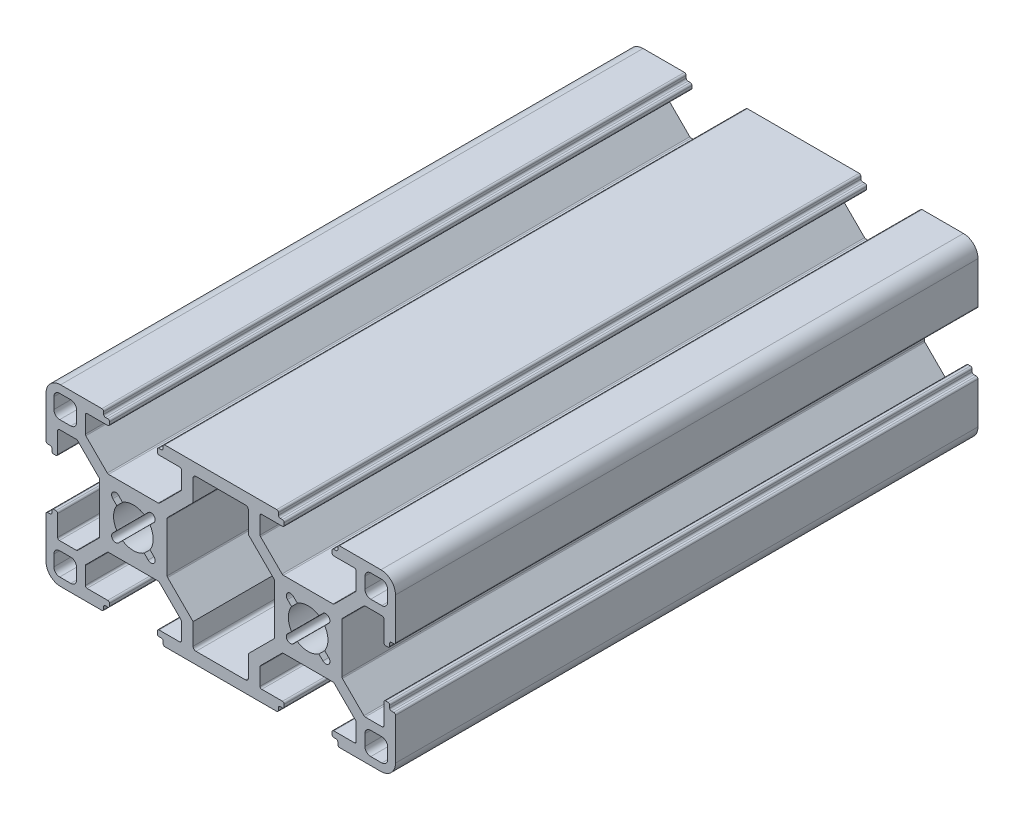
from build123d import *

# Parameters (mm, degrees)
EXTRUDE_1_DEPTH = 100


with BuildPart() as part:
    # 草图1 → 凸台-拉伸1 (new body)
    with BuildSketch(Plane.XY):
        with BuildLine():
            Line((7.95, -13), (4.4, -13))
            ThreePointArc((4.4, -13), (4.187867966, -13.087867966), (4.1, -13.3))
            Line((4.1, -13.3), (4.1, -13.7))
            ThreePointArc((4.1, -13.7), (4.187867966, -13.912132034), (4.4, -14))
            Line((4.4, -14), (4.8, -14))
            ThreePointArc((4.8, -14), (5.012132034, -14.087867966), (5.1, -14.3))
            Line((5.1, -14.3), (5.1, -14.7))
            ThreePointArc((5.1, -14.7), (5.187867966, -14.912132034), (5.4, -15))
            Line((5.4, -15), (24.6, -15))
            ThreePointArc((24.6, -15), (24.812132034, -14.912132034), (24.9, -14.7))
            Line((24.9, -14.7), (24.9, -14.3))
            ThreePointArc((24.9, -14.3), (24.987867966, -14.087867966), (25.2, -14))
            Line((25.2, -14), (25.6, -14))
            ThreePointArc((25.6, -14), (25.812132034, -13.912132034), (25.9, -13.7))
            Line((25.9, -13.7), (25.9, -13.3))
            ThreePointArc((25.9, -13.3), (25.812132034, -13.087867966), (25.6, -13))
            Line((25.6, -13), (22.05, -13))
            ThreePointArc((22.05, -13), (21.837867966, -12.912132034), (21.75, -12.7))
            Line((21.75, -12.7), (21.75, -9.788477631))
            ThreePointArc((21.75, -9.788477631), (21.77283614, -9.673672601), (21.837867966, -9.576345597))
            Line((21.837867966, -9.576345597), (25.526345597, -5.887867966))
            ThreePointArc((25.526345597, -5.887867966), (25.623672601, -5.82283614), (25.738477631, -5.8))
            Line((25.738477631, -5.8), (34.261522369, -5.8))
            ThreePointArc((34.261522369, -5.8), (34.376327399, -5.82283614), (34.473654403, -5.887867966))
            Line((34.473654403, -5.887867966), (38.162132034, -9.576345597))
            ThreePointArc((38.162132034, -9.576345597), (38.22716386, -9.673672601), (38.25, -9.788477631))
            Line((38.25, -9.788477631), (38.25, -12.7))
            ThreePointArc((38.25, -12.7), (38.162132034, -12.912132034), (37.95, -13))
            Line((37.95, -13), (34.4, -13))
            ThreePointArc((34.4, -13), (34.187867966, -13.087867966), (34.1, -13.3))
            Line((34.1, -13.3), (34.1, -13.7))
            ThreePointArc((34.1, -13.7), (34.187867966, -13.912132034), (34.4, -14))
            Line((34.4, -14), (34.8, -14))
            ThreePointArc((34.8, -14), (35.012132034, -14.087867966), (35.1, -14.3))
            Line((35.1, -14.3), (35.1, -14.7))
            ThreePointArc((35.1, -14.7), (35.187867966, -14.912132034), (35.4, -15))
            Line((35.4, -15), (42.5, -15))
            ThreePointArc((42.5, -15), (44.267766953, -14.267766953), (45, -12.5))
            Line((45, -12.5), (45, -5.4))
            ThreePointArc((45, -5.4), (44.912132034, -5.187867966), (44.7, -5.1))
            Line((44.7, -5.1), (44.3, -5.1))
            ThreePointArc((44.3, -5.1), (44.087867966, -5.012132034), (44, -4.8))
            Line((44, -4.8), (44, -4.4))
            ThreePointArc((44, -4.4), (43.912132034, -4.187867966), (43.7, -4.1))
            Line((43.7, -4.1), (43.3, -4.1))
            ThreePointArc((43.3, -4.1), (43.087867966, -4.187867966), (43, -4.4))
            Line((43, -4.4), (43, -7.95))
            ThreePointArc((43, -7.95), (42.912132034, -8.162132034), (42.7, -8.25))
            Line((42.7, -8.25), (39.788477631, -8.25))
            ThreePointArc((39.788477631, -8.25), (39.673672601, -8.22716386), (39.576345597, -8.162132034))
            Line((39.576345597, -8.162132034), (35.887867966, -4.473654403))
            ThreePointArc((35.887867966, -4.473654403), (35.82283614, -4.376327399), (35.8, -4.261522369))
            Line((35.8, -4.261522369), (35.8, 4.261522369))
            ThreePointArc((35.8, 4.261522369), (35.82283614, 4.376327399), (35.887867966, 4.473654403))
            Line((35.887867966, 4.473654403), (39.576345597, 8.162132034))
            ThreePointArc((39.576345597, 8.162132034), (39.673672601, 8.22716386), (39.788477631, 8.25))
            Line((39.788477631, 8.25), (42.7, 8.25))
            ThreePointArc((42.7, 8.25), (42.912132034, 8.162132034), (43, 7.95))
            Line((43, 7.95), (43, 4.4))
            ThreePointArc((43, 4.4), (43.087867966, 4.187867966), (43.3, 4.1))
            Line((43.3, 4.1), (43.7, 4.1))
            ThreePointArc((43.7, 4.1), (43.912132034, 4.187867966), (44, 4.4))
            Line((44, 4.4), (44, 4.8))
            ThreePointArc((44, 4.8), (44.087867966, 5.012132034), (44.3, 5.1))
            Line((44.3, 5.1), (44.7, 5.1))
            ThreePointArc((44.7, 5.1), (44.912132034, 5.187867966), (45, 5.4))
            Line((45, 5.4), (45, 12.5))
            ThreePointArc((45, 12.5), (44.267766953, 14.267766953), (42.5, 15))
            Line((42.5, 15), (35.4, 15))
            ThreePointArc((35.4, 15), (35.187867966, 14.912132034), (35.1, 14.7))
            Line((35.1, 14.7), (35.1, 14.3))
            ThreePointArc((35.1, 14.3), (35.012132034, 14.087867966), (34.8, 14))
            Line((34.8, 14), (34.4, 14))
            ThreePointArc((34.4, 14), (34.187867966, 13.912132034), (34.1, 13.7))
            Line((34.1, 13.7), (34.1, 13.3))
            ThreePointArc((34.1, 13.3), (34.187867966, 13.087867966), (34.4, 13))
            Line((34.4, 13), (37.95, 13))
            ThreePointArc((37.95, 13), (38.162132034, 12.912132034), (38.25, 12.7))
            Line((38.25, 12.7), (38.25, 9.788477631))
            ThreePointArc((38.25, 9.788477631), (38.22716386, 9.673672601), (38.162132034, 9.576345597))
            Line((38.162132034, 9.576345597), (34.473654403, 5.887867966))
            ThreePointArc((34.473654403, 5.887867966), (34.376327399, 5.82283614), (34.261522369, 5.8))
            Line((34.261522369, 5.8), (25.738477631, 5.8))
            ThreePointArc((25.738477631, 5.8), (25.623672601, 5.82283614), (25.526345597, 5.887867966))
            Line((25.526345597, 5.887867966), (21.837867966, 9.576345597))
            ThreePointArc((21.837867966, 9.576345597), (21.77283614, 9.673672601), (21.75, 9.788477631))
            Line((21.75, 9.788477631), (21.75, 12.7))
            ThreePointArc((21.75, 12.7), (21.837867966, 12.912132034), (22.05, 13))
            Line((22.05, 13), (25.6, 13))
            ThreePointArc((25.6, 13), (25.812132034, 13.087867966), (25.9, 13.3))
            Line((25.9, 13.3), (25.9, 13.7))
            ThreePointArc((25.9, 13.7), (25.812132034, 13.912132034), (25.6, 14))
            Line((25.6, 14), (25.2, 14))
            ThreePointArc((25.2, 14), (24.987867966, 14.087867966), (24.9, 14.3))
            Line((24.9, 14.3), (24.9, 14.7))
            ThreePointArc((24.9, 14.7), (24.812132034, 14.912132034), (24.6, 15))
            Line((24.6, 15), (5.4, 15))
            ThreePointArc((5.4, 15), (5.187867966, 14.912132034), (5.1, 14.7))
            Line((5.1, 14.7), (5.1, 14.3))
            ThreePointArc((5.1, 14.3), (5.012132034, 14.087867966), (4.8, 14))
            Line((4.8, 14), (4.4, 14))
            ThreePointArc((4.4, 14), (4.187867966, 13.912132034), (4.1, 13.7))
            Line((4.1, 13.7), (4.1, 13.3))
            ThreePointArc((4.1, 13.3), (4.187867966, 13.087867966), (4.4, 13))
            Line((4.4, 13), (7.95, 13))
            ThreePointArc((7.95, 13), (8.162132034, 12.912132034), (8.25, 12.7))
            Line((8.25, 12.7), (8.25, 9.788477631))
            ThreePointArc((8.25, 9.788477631), (8.22716386, 9.673672601), (8.162132034, 9.576345597))
            Line((8.162132034, 9.576345597), (4.473654403, 5.887867966))
            ThreePointArc((4.473654403, 5.887867966), (4.376327399, 5.82283614), (4.261522369, 5.8))
            Line((4.261522369, 5.8), (-4.261522369, 5.8))
            ThreePointArc((-4.261522369, 5.8), (-4.376327399, 5.82283614), (-4.473654403, 5.887867966))
            Line((-4.473654403, 5.887867966), (-8.162132034, 9.576345597))
            ThreePointArc((-8.162132034, 9.576345597), (-8.22716386, 9.673672601), (-8.25, 9.788477631))
            Line((-8.25, 9.788477631), (-8.25, 12.7))
            ThreePointArc((-8.25, 12.7), (-8.162132034, 12.912132034), (-7.95, 13))
            Line((-7.95, 13), (-4.4, 13))
            ThreePointArc((-4.4, 13), (-4.187867966, 13.087867966), (-4.1, 13.3))
            Line((-4.1, 13.3), (-4.1, 13.7))
            ThreePointArc((-4.1, 13.7), (-4.187867966, 13.912132034), (-4.4, 14))
            Line((-4.4, 14), (-4.8, 14))
            ThreePointArc((-4.8, 14), (-5.012132034, 14.087867966), (-5.1, 14.3))
            Line((-5.1, 14.3), (-5.1, 14.7))
            ThreePointArc((-5.1, 14.7), (-5.187867966, 14.912132034), (-5.4, 15))
            Line((-5.4, 15), (-12.5, 15))
            ThreePointArc((-12.5, 15), (-14.267766953, 14.267766953), (-15, 12.5))
            Line((-15, 12.5), (-15, 5.4))
            ThreePointArc((-15, 5.4), (-14.912132034, 5.187867966), (-14.7, 5.1))
            Line((-14.7, 5.1), (-14.3, 5.1))
            ThreePointArc((-14.3, 5.1), (-14.087867966, 5.012132034), (-14, 4.8))
            Line((-14, 4.8), (-14, 4.4))
            ThreePointArc((-14, 4.4), (-13.912132034, 4.187867966), (-13.7, 4.1))
            Line((-13.7, 4.1), (-13.3, 4.1))
            ThreePointArc((-13.3, 4.1), (-13.087867966, 4.187867966), (-13, 4.4))
            Line((-13, 4.4), (-13, 7.95))
            ThreePointArc((-13, 7.95), (-12.912132034, 8.162132034), (-12.7, 8.25))
            Line((-12.7, 8.25), (-9.788477631, 8.25))
            ThreePointArc((-9.788477631, 8.25), (-9.673672601, 8.22716386), (-9.576345597, 8.162132034))
            Line((-9.576345597, 8.162132034), (-5.887867966, 4.473654403))
            ThreePointArc((-5.887867966, 4.473654403), (-5.82283614, 4.376327399), (-5.8, 4.261522369))
            Line((-5.8, 4.261522369), (-5.8, -4.261522369))
            ThreePointArc((-5.8, -4.261522369), (-5.82283614, -4.376327399), (-5.887867966, -4.473654403))
            Line((-5.887867966, -4.473654403), (-9.576345597, -8.162132034))
            ThreePointArc((-9.576345597, -8.162132034), (-9.673672601, -8.22716386), (-9.788477631, -8.25))
            Line((-9.788477631, -8.25), (-12.7, -8.25))
            ThreePointArc((-12.7, -8.25), (-12.912132034, -8.162132034), (-13, -7.95))
            Line((-13, -7.95), (-13, -4.4))
            ThreePointArc((-13, -4.4), (-13.087867966, -4.187867966), (-13.3, -4.1))
            Line((-13.3, -4.1), (-13.7, -4.1))
            ThreePointArc((-13.7, -4.1), (-13.912132034, -4.187867966), (-14, -4.4))
            Line((-14, -4.4), (-14, -4.8))
            ThreePointArc((-14, -4.8), (-14.087867966, -5.012132034), (-14.3, -5.1))
            Line((-14.3, -5.1), (-14.7, -5.1))
            ThreePointArc((-14.7, -5.1), (-14.912132034, -5.187867966), (-15, -5.4))
            Line((-15, -5.4), (-15, -12.5))
            ThreePointArc((-15, -12.5), (-14.267766953, -14.267766953), (-12.5, -15))
            Line((-12.5, -15), (-5.4, -15))
            ThreePointArc((-5.4, -15), (-5.187867966, -14.912132034), (-5.1, -14.7))
            Line((-5.1, -14.7), (-5.1, -14.3))
            ThreePointArc((-5.1, -14.3), (-5.012132034, -14.087867966), (-4.8, -14))
            Line((-4.8, -14), (-4.4, -14))
            ThreePointArc((-4.4, -14), (-4.187867966, -13.912132034), (-4.1, -13.7))
            Line((-4.1, -13.7), (-4.1, -13.3))
            ThreePointArc((-4.1, -13.3), (-4.187867966, -13.087867966), (-4.4, -13))
            Line((-4.4, -13), (-7.95, -13))
            ThreePointArc((-7.95, -13), (-8.162132034, -12.912132034), (-8.25, -12.7))
            Line((-8.25, -12.7), (-8.25, -9.788477631))
            ThreePointArc((-8.25, -9.788477631), (-8.22716386, -9.673672601), (-8.162132034, -9.576345597))
            Line((-8.162132034, -9.576345597), (-4.473654403, -5.887867966))
            ThreePointArc((-4.473654403, -5.887867966), (-4.376327399, -5.82283614), (-4.261522369, -5.8))
            Line((-4.261522369, -5.8), (4.261522369, -5.8))
            ThreePointArc((4.261522369, -5.8), (4.376327399, -5.82283614), (4.473654403, -5.887867966))
            Line((4.473654403, -5.887867966), (8.162132034, -9.576345597))
            ThreePointArc((8.162132034, -9.576345597), (8.22716386, -9.673672601), (8.25, -9.788477631))
            Line((8.25, -9.788477631), (8.25, -12.7))
            ThreePointArc((8.25, -12.7), (8.162132034, -12.912132034), (7.95, -13))
        make_face()
        with BuildLine():
            Line((39.75, -10.75), (39.75, -12.65))
            ThreePointArc((39.75, -12.65), (40.042893219, -13.357106781), (40.75, -13.65))
            Line((40.75, -13.65), (42.65, -13.65))
            ThreePointArc((42.65, -13.65), (43.357106781, -13.357106781), (43.65, -12.65))
            Line((43.65, -12.65), (43.65, -10.75))
            ThreePointArc((43.65, -10.75), (43.357106781, -10.042893219), (42.65, -9.75))
            Line((42.65, -9.75), (40.75, -9.75))
            ThreePointArc((40.75, -9.75), (40.042893219, -10.042893219), (39.75, -10.75))
        make_face(mode=Mode.SUBTRACT)
        with BuildLine():
            Line((40.75, 9.75), (42.65, 9.75))
            ThreePointArc((42.65, 9.75), (43.357106781, 10.042893219), (43.65, 10.75))
            Line((43.65, 10.75), (43.65, 12.65))
            ThreePointArc((43.65, 12.65), (43.357106781, 13.357106781), (42.65, 13.65))
            Line((42.65, 13.65), (40.75, 13.65))
            ThreePointArc((40.75, 13.65), (40.042893219, 13.357106781), (39.75, 12.65))
            Line((39.75, 12.65), (39.75, 10.75))
            ThreePointArc((39.75, 10.75), (40.042893219, 10.042893219), (40.75, 9.75))
        make_face(mode=Mode.SUBTRACT)
        with BuildLine():
            Line((32.545584412, 3.535533906), (31.857683324, 2.847632818))
            ThreePointArc((31.857683324, 2.847632818), (30, 3.4), (28.142316676, 2.847632818))
            Line((28.142316676, 2.847632818), (27.454415588, 3.535533906))
            ThreePointArc((27.454415588, 3.535533906), (26.464466094, 3.535533906), (26.464466094, 2.545584412))
            Line((26.464466094, 2.545584412), (27.152367182, 1.857683324))
            ThreePointArc((27.152367182, 1.857683324), (26.6, 0), (27.152367182, -1.857683324))
            Line((27.152367182, -1.857683324), (26.464466094, -2.545584412))
            ThreePointArc((26.464466094, -2.545584412), (26.464466094, -3.535533906), (27.454415588, -3.535533906))
            Line((27.454415588, -3.535533906), (28.142316676, -2.847632818))
            ThreePointArc((28.142316676, -2.847632818), (30, -3.4), (31.857683324, -2.847632818))
            Line((31.857683324, -2.847632818), (32.545584412, -3.535533906))
            ThreePointArc((32.545584412, -3.535533906), (33.535533906, -3.535533906), (33.535533906, -2.545584412))
            Line((33.535533906, -2.545584412), (32.847632818, -1.857683324))
            ThreePointArc((32.847632818, -1.857683324), (33.4, 0), (32.847632818, 1.857683324))
            Line((32.847632818, 1.857683324), (33.535533906, 2.545584412))
            ThreePointArc((33.535533906, 2.545584412), (33.535533906, 3.535533906), (32.545584412, 3.535533906))
        make_face(mode=Mode.SUBTRACT)
        with BuildLine():
            Line((10.75, -13), (19.25, -13))
            ThreePointArc((19.25, -13), (19.603553391, -12.853553391), (19.75, -12.5))
            Line((19.75, -12.5), (19.75, -8.835786438))
            Line((19.75, -8.835786438), (24.112132034, -4.473654403))
            ThreePointArc((24.112132034, -4.473654403), (24.17716386, -4.376327399), (24.2, -4.261522369))
            Line((24.2, -4.261522369), (24.2, 4.261522369))
            ThreePointArc((24.2, 4.261522369), (24.17716386, 4.376327399), (24.112132034, 4.473654403))
            Line((24.112132034, 4.473654403), (19.75, 8.835786438))
            Line((19.75, 8.835786438), (19.75, 12.5))
            ThreePointArc((19.75, 12.5), (19.603553391, 12.853553391), (19.25, 13))
            Line((19.25, 13), (10.75, 13))
            ThreePointArc((10.75, 13), (10.396446609, 12.853553391), (10.25, 12.5))
            Line((10.25, 12.5), (10.25, 8.835786438))
            Line((10.25, 8.835786438), (5.887867966, 4.473654403))
            ThreePointArc((5.887867966, 4.473654403), (5.82283614, 4.376327399), (5.8, 4.261522369))
            Line((5.8, 4.261522369), (5.8, -4.261522369))
            ThreePointArc((5.8, -4.261522369), (5.82283614, -4.376327399), (5.887867966, -4.473654403))
            Line((5.887867966, -4.473654403), (10.25, -8.835786438))
            Line((10.25, -8.835786438), (10.25, -12.5))
            ThreePointArc((10.25, -12.5), (10.396446609, -12.853553391), (10.75, -13))
        make_face(mode=Mode.SUBTRACT)
        with BuildLine():
            Line((2.545584412, 3.535533906), (1.857683324, 2.847632818))
            ThreePointArc((1.857683324, 2.847632818), (0, 3.4), (-1.857683324, 2.847632818))
            Line((-1.857683324, 2.847632818), (-2.545584412, 3.535533906))
            ThreePointArc((-2.545584412, 3.535533906), (-3.535533906, 3.535533906), (-3.535533906, 2.545584412))
            Line((-3.535533906, 2.545584412), (-2.847632818, 1.857683324))
            ThreePointArc((-2.847632818, 1.857683324), (-3.4, 0), (-2.847632818, -1.857683324))
            Line((-2.847632818, -1.857683324), (-3.535533906, -2.545584412))
            ThreePointArc((-3.535533906, -2.545584412), (-3.535533906, -3.535533906), (-2.545584412, -3.535533906))
            Line((-2.545584412, -3.535533906), (-1.857683324, -2.847632818))
            ThreePointArc((-1.857683324, -2.847632818), (0, -3.4), (1.857683324, -2.847632818))
            Line((1.857683324, -2.847632818), (2.545584412, -3.535533906))
            ThreePointArc((2.545584412, -3.535533906), (3.535533906, -3.535533906), (3.535533906, -2.545584412))
            Line((3.535533906, -2.545584412), (2.847632818, -1.857683324))
            ThreePointArc((2.847632818, -1.857683324), (3.4, 0), (2.847632818, 1.857683324))
            Line((2.847632818, 1.857683324), (3.535533906, 2.545584412))
            ThreePointArc((3.535533906, 2.545584412), (3.535533906, 3.535533906), (2.545584412, 3.535533906))
        make_face(mode=Mode.SUBTRACT)
        with BuildLine():
            Line((-9.75, 10.75), (-9.75, 12.65))
            ThreePointArc((-9.75, 12.65), (-10.042893219, 13.357106781), (-10.75, 13.65))
            Line((-10.75, 13.65), (-12.65, 13.65))
            ThreePointArc((-12.65, 13.65), (-13.357106781, 13.357106781), (-13.65, 12.65))
            Line((-13.65, 12.65), (-13.65, 10.75))
            ThreePointArc((-13.65, 10.75), (-13.357106781, 10.042893219), (-12.65, 9.75))
            Line((-12.65, 9.75), (-10.75, 9.75))
            ThreePointArc((-10.75, 9.75), (-10.042893219, 10.042893219), (-9.75, 10.75))
        make_face(mode=Mode.SUBTRACT)
        with BuildLine():
            Line((-10.75, -9.75), (-12.65, -9.75))
            ThreePointArc((-12.65, -9.75), (-13.357106781, -10.042893219), (-13.65, -10.75))
            Line((-13.65, -10.75), (-13.65, -12.65))
            ThreePointArc((-13.65, -12.65), (-13.357106781, -13.357106781), (-12.65, -13.65))
            Line((-12.65, -13.65), (-10.75, -13.65))
            ThreePointArc((-10.75, -13.65), (-10.042893219, -13.357106781), (-9.75, -12.65))
            Line((-9.75, -12.65), (-9.75, -10.75))
            ThreePointArc((-9.75, -10.75), (-10.042893219, -10.042893219), (-10.75, -9.75))
        make_face(mode=Mode.SUBTRACT)
    extrude(amount=EXTRUDE_1_DEPTH)


solid = part.part
